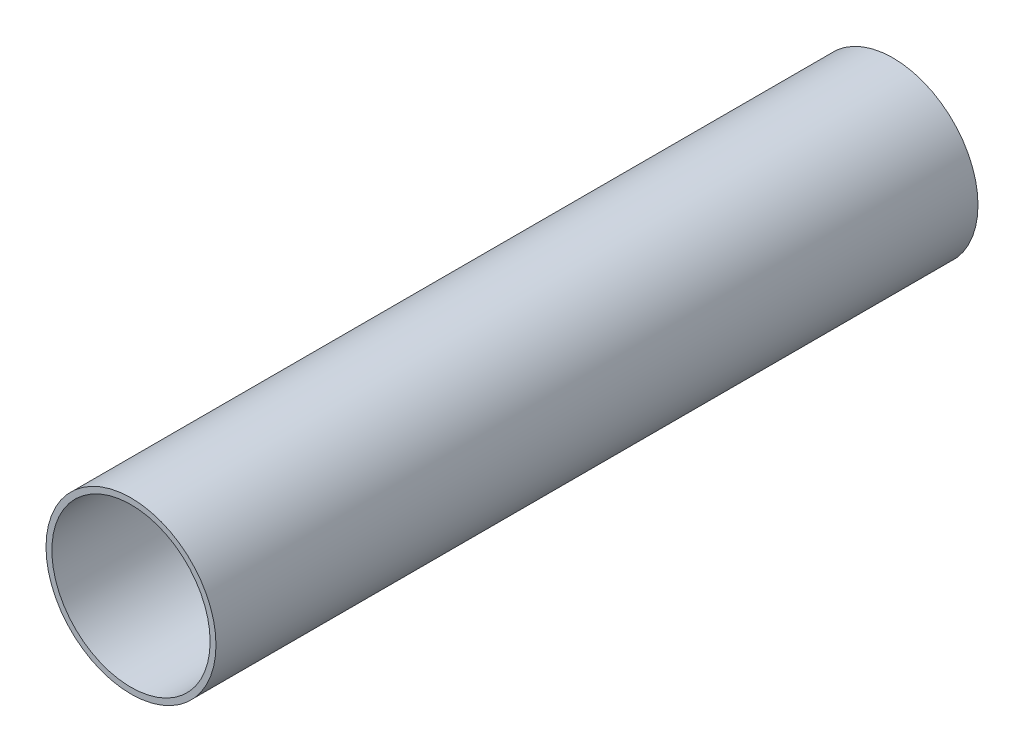
from build123d import *

# Parameters (mm, degrees)
SKETCH1_R           = 29
SKETCH1_R_2         = 27
BOSS_EXTRUDE1_DEPTH = 260


with BuildPart() as part:
    # Sketch1 → Boss-Extrude1 (new body)
    with BuildSketch(Plane.XY):
        Circle(SKETCH1_R)
        Circle(SKETCH1_R_2, mode=Mode.SUBTRACT)
    extrude(amount=BOSS_EXTRUDE1_DEPTH)


solid = part.part
